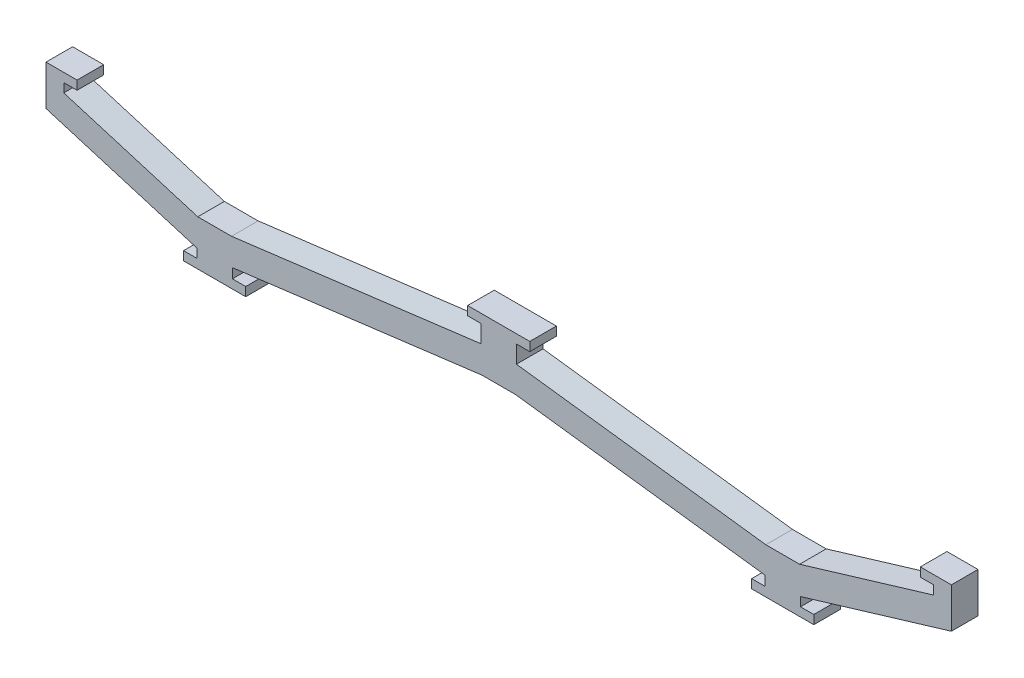
from build123d import *

# Parameters (mm, degrees)
BOSS_EXTRU_1_DEPTH = 15


with BuildPart() as part:
    # Esquisse1 → Boss.-Extru.1 (new body)
    with BuildSketch(Plane.XY):
        Polygon((-7.5, 10), (10, 10), (10, 5), (2.5, 5), (2.5, 0), (78, -22.706766917), (97, -22.706766917), (237.5, -4.880806596), (237.5, 5), (230, 5), (230, 10), (265, 10), (265, 5), (257.5, 5), (257.5, -4.880806596), (398, -22.706766917), (417, -22.706766917), (492.5, 0), (492.5, 5), (485, 5), (485, 10), (502.5, 10), (502.5, -12.656185457), (417.5, -38.220095231), (417.5, -43.220095231), (425, -43.220095231), (425, -48.220095231), (390, -48.220095231), (390, -43.220095231), (397.5, -43.220095231), (397.5, -37.763577153), (257, -19.937616831), (238, -19.937616831), (97.5, -37.763577153), (97.5, -43.220095231), (105, -43.220095231), (105, -48.220095231), (70, -48.220095231), (70, -43.220095231), (77.5, -43.220095231), (77.5, -38.220095231), (-7.5, -12.656185457), align=None)
    extrude(amount=BOSS_EXTRU_1_DEPTH)


solid = part.part
